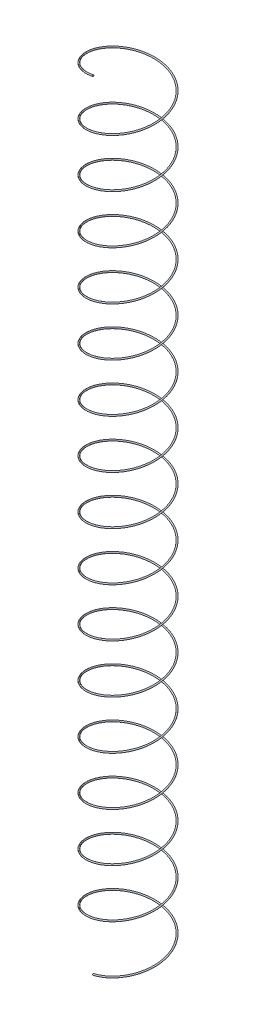
from build123d import *

# Parameters (mm, degrees)
DEPLOYED_PITCH  = 28.6
DEPLOYED_HEIGHT = 457.6
DEPLOYED_RADIUS = 20.404999957
SKETCH7_R       = 0.405


with BuildPart() as part:
    # Deployed: sweep along a helix
    with BuildLine() as deployed_path:
        Helix(DEPLOYED_PITCH, DEPLOYED_HEIGHT, DEPLOYED_RADIUS, center=(0, 0, 0), direction=(0, 1, 0))
    # Sketch7 → Deployed (sweep)
    with BuildSketch(Plane(origin=(0, 0, 0), x_dir=(0, 0, -1), z_dir=(1, 0, 0))):
        with Locations((-20.404999957, 0)):
            Circle(SKETCH7_R)
    sweep(path=deployed_path.line, is_frenet=True)


solid = part.part
